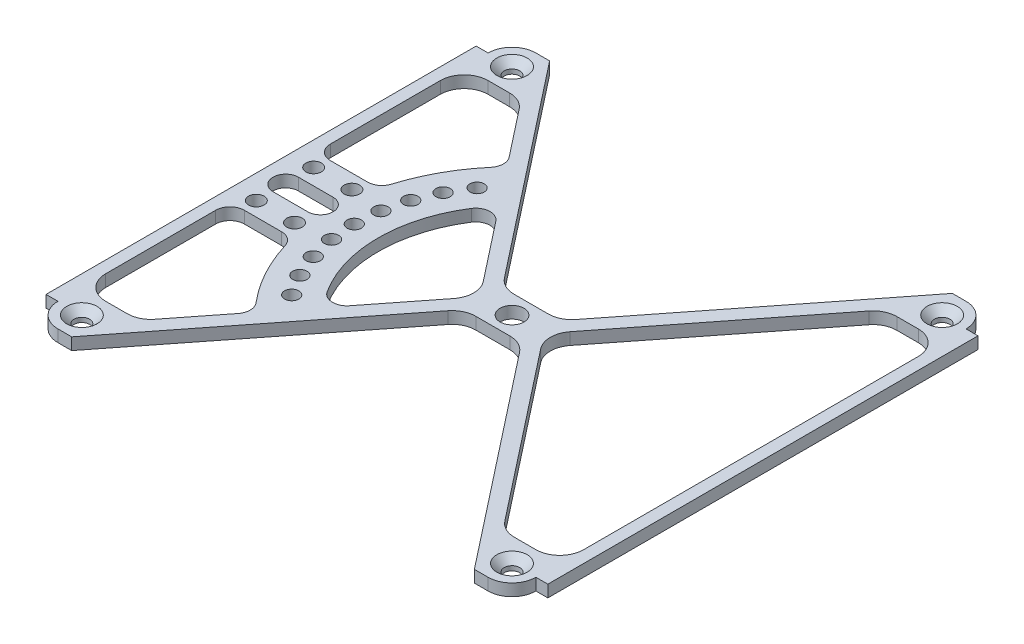
from build123d import *

# Parameters (mm, degrees)
SKETCH1_R           = 1.625
SKETCH1_R_2         = 2.5
BOSS_EXTRUDE1_DEPTH = 2.5
FILLET1_R           = 5
FILLET2_R           = 5
CHAMFER1_SIZE       = 1.55
SKETCH3_R           = 1.625
SKETCH3_R_2         = 1.5
BOSS_EXTRUDE2_DEPTH = 2.5
FILLET3_R           = 3


with BuildPart() as part:
    # Sketch1 → Boss-Extrude1 (new body)
    with BuildSketch(Plane(origin=(0, 0, 0), x_dir=(1, 0, 0), z_dir=(0, 1, 0))):
        with BuildLine():
            Line((-52.5, 45), (-52.5, -45))
            Line((-52.5, -45), (-50, -45))
            ThreePointArc((-50, -45), (-48.535533906, -48.535533906), (-45, -50))
            Line((-45, -50), (-42.127158908, -50))
            Line((-42.127158908, -50), (-6, -4))
            Line((-6, -4), (6, -4))
            Line((6, -4), (42.127158908, -50))
            Line((42.127158908, -50), (45, -50))
            ThreePointArc((45, -50), (48.535533906, -48.535533906), (50, -45))
            Line((50, -45), (52.5, -45))
            Line((52.5, -45), (52.5, 45))
            Line((52.5, 45), (50, 45))
            ThreePointArc((50, 45), (48.535533906, 48.535533906), (45, 50))
            Line((45, 50), (42.127158908, 50))
            Line((42.127158908, 50), (6, 4))
            Line((6, 4), (-6, 4))
            Line((-6, 4), (-42.127158908, 50))
            Line((-42.127158908, 50), (-45, 50))
            ThreePointArc((-45, 50), (-48.535533906, 48.535533906), (-50, 45))
            Line((-50, 45), (-52.5, 45))
        make_face()
        with Locations(Location((-45, 45, 0), (0, 0, 270))):
            Circle(SKETCH1_R, mode=Mode.SUBTRACT)
        with Locations(Location((45, 45, 0), (0, 0, 270))):
            Circle(SKETCH1_R, mode=Mode.SUBTRACT)
        with Locations(Location((-45, -45, 0), (0, 0, 270))):
            Circle(SKETCH1_R, mode=Mode.SUBTRACT)
        with Locations(Location((45, -45, 0), (0, 0, 270))):
            Circle(SKETCH1_R, mode=Mode.SUBTRACT)
        with Locations(Location((0, 0, 0), (0, 0, 270))):
            Circle(SKETCH1_R_2, mode=Mode.SUBTRACT)
        Polygon((-50, 40), (-50, -40), (-38.088044946, -40), (-6.673124156, 0), (-38.088044946, 40), align=None, mode=Mode.SUBTRACT)
        Polygon((50, -40), (38.088044946, -40), (6.673124156, 0), (38.088044946, 40), (50, 40), align=None, mode=Mode.SUBTRACT)
    extrude(amount=BOSS_EXTRUDE1_DEPTH)

    # Fillet1
    fillet1_edges = [part.edges().sort_by_distance(p)[0] for p in [
        (-6, 1.25, -4),
        (6, 1.25, -4),
        (6, 1.25, 4),
        (-6, 1.25, 4),
        (-6.673124156, 1.25, 0),
        (6.673124156, 1.25, 0),
    ]]
    fillet(fillet1_edges, radius=FILLET1_R)

    # Fillet2
    fillet2_edges = [part.edges().sort_by_distance(p)[0] for p in [
        (-38.088044946, 1.25, -40),
        (-50, 1.25, -40),
        (-50, 1.25, 40),
        (-38.088044946, 1.25, 40),
        (50, 1.25, 40),
        (50, 1.25, -40),
        (38.088044946, 1.25, -40),
        (38.088044946, 1.25, 40),
    ]]
    fillet(fillet2_edges, radius=FILLET2_R)

    # Chamfer1
    chamfer1_edges = [part.edges().sort_by_distance(p)[0] for p in [
        (-45, 2.5, -46.625),
        (45, 2.5, -46.625),
        (-45, 2.5, 43.375),
        (45, 2.5, 43.375),
    ]]
    chamfer(chamfer1_edges, length=CHAMFER1_SIZE)

    # Sketch3 → Boss-Extrude2 (add)
    with BuildSketch(Plane(origin=(0, 2.5, 0), x_dir=(1, 0, 0), z_dir=(0, 1, 0))):
        with BuildLine():
            Line((-27.373335632, 26.357171631), (-21.115199634, 18.388810304))
            ThreePointArc((-21.115199634, 18.388810304), (-28, 0), (-21.115199634, -18.388810304))
            Line((-21.115199634, -18.388810304), (-27.373335632, -26.357171631))
            ThreePointArc((-27.373335632, -26.357171631), (-33.296974163, -18.311513088), (-36.918829884, -9))
            Line((-36.918829884, -9), (-52.5, -9))
            Line((-52.5, -9), (-52.5, 9))
            Line((-52.5, 9), (-36.918829884, 9))
            ThreePointArc((-36.918829884, 9), (-33.296974163, 18.311513088), (-27.373335632, 26.357171631))
        make_face()
        with Locations(Location((-47.5, 6, 0), (0, 0, 270))):
            Circle(SKETCH3_R, mode=Mode.SUBTRACT)
        with Locations(Location((-39.5, 6, 0), (0, 0, 270))):
            Circle(SKETCH3_R, mode=Mode.SUBTRACT)
        with Locations(Location((-39.5, -6, 0), (0, 0, 90))):
            Circle(SKETCH3_R, mode=Mode.SUBTRACT)
        with Locations(Location((-47.5, -6, 0), (0, 0, 90))):
            Circle(SKETCH3_R, mode=Mode.SUBTRACT)
        with Locations(Location((-33, 0, 0), (0, 0, 270))):
            Circle(SKETCH3_R_2, mode=Mode.SUBTRACT)
        with Locations(Location((-32.59371524, 5.162337346, 0), (0, 0, 270))):
            Circle(SKETCH3_R_2, mode=Mode.SUBTRACT)
        with Locations(Location((-31.384865038, 10.197560814, 0), (0, 0, 270))):
            Circle(SKETCH3_R_2, mode=Mode.SUBTRACT)
        with Locations(Location((-29.403215298, 14.981686491, 0), (0, 0, 270))):
            Circle(SKETCH3_R_2, mode=Mode.SUBTRACT)
        with Locations(Location((-26.697560814, 19.396913326, 0), (0, 0, 270))):
            Circle(SKETCH3_R_2, mode=Mode.SUBTRACT)
        with Locations(Location((-26.697560814, -19.396913326, 0), (0, 0, 270))):
            Circle(SKETCH3_R_2, mode=Mode.SUBTRACT)
        with Locations(Location((-29.403215298, -14.981686491, 0), (0, 0, 270))):
            Circle(SKETCH3_R_2, mode=Mode.SUBTRACT)
        with Locations(Location((-31.384865038, -10.197560814, 0), (0, 0, 270))):
            Circle(SKETCH3_R_2, mode=Mode.SUBTRACT)
        with Locations(Location((-32.59371524, -5.162337346, 0), (0, 0, 270))):
            Circle(SKETCH3_R_2, mode=Mode.SUBTRACT)
        with BuildLine():
            Line((-47.353810883, 2.646189117), (-40.079768039, 2.646189117))
            ThreePointArc((-40.079768039, 2.646189117), (-37.433578922, 0), (-40.079768039, -2.646189117))
            Line((-40.079768039, -2.646189117), (-47.353810883, -2.646189117))
            ThreePointArc((-47.353810883, -2.646189117), (-50, 0), (-47.353810883, 2.646189117))
        make_face(mode=Mode.SUBTRACT)
    extrude(amount=-BOSS_EXTRUDE2_DEPTH)

    # Fillet3
    fillet3_edges = [part.edges().sort_by_distance(p)[0] for p in [
        (-50, 1.25, -9),
        (-50, 1.25, 9),
        (-36.918829884, 1.25, -9),
        (-27.373335632, 1.25, -26.357171631),
        (-21.115199634, 1.25, -18.388810304),
        (-21.115199634, 1.25, 18.388810304),
        (-27.373335632, 1.25, 26.357171631),
        (-36.918829884, 1.25, 9),
    ]]
    fillet(fillet3_edges, radius=FILLET3_R)


solid = part.part
